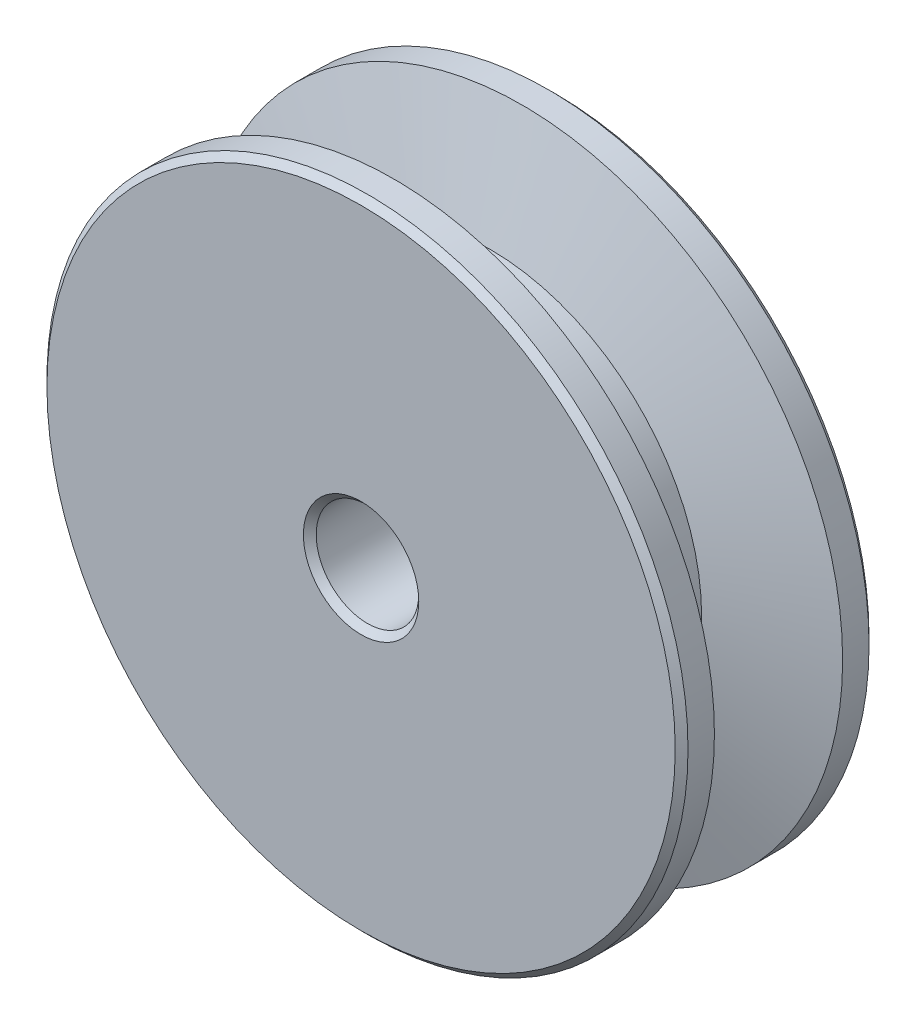
from build123d import *

# Parameters (mm, degrees)
EXTRUDE_1_DEPTH      = 7.56
EXTRUDE_1_DEPTH_BACK = 7.56
SKETCH_1_R           = 25
SKETCH_1_R_2         = 4
SKETCH_4_R           = 2.1
CUT_EXTRUDE_1_DEPTH  = 37.15457924
SKETCH_5_R           = 2.1
CUT_EXTRUDE_2_DEPTH  = 37.154579261
CHAMFER_1_SIZE       = 0.5


with BuildPart() as part:
    # 草图1 → 凸台-拉伸1 (new, two sides: drawn at the far end of the back side and taken through both)
    with BuildSketch(Plane.XY.offset(-EXTRUDE_1_DEPTH_BACK)):
        Circle(SKETCH_1_R)
        Circle(SKETCH_1_R_2, mode=Mode.SUBTRACT)
    extrude(amount=EXTRUDE_1_DEPTH + EXTRUDE_1_DEPTH_BACK)

    # 草图3 → 切除-旋转2 (revolve, cut)
    with BuildSketch(Plane(origin=(0, 0, 0), x_dir=(0, 0, -1), z_dir=(1, 0, 0))):
        Polygon((-5, 25), (5, 25), (2.5, 16.5), (-2.5, 16.5), align=None)
    revolve(axis=Axis((0, 0, 7.56), (0, 0, -1)), mode=Mode.SUBTRACT)

    # 草图4 → 切除-拉伸1 (cut, through all)
    with BuildSketch(Plane(origin=(0, 0, 0), x_dir=(1, 0, 0), z_dir=(0, 1, 0))):
        Circle(SKETCH_4_R)
    extrude(amount=CUT_EXTRUDE_1_DEPTH, mode=Mode.SUBTRACT)

    # 草图5 → 切除-拉伸2 (cut, through all)
    with BuildSketch(Plane(origin=(0, 0, 0), x_dir=(0, 0, -1), z_dir=(1, 0, 0))):
        Circle(SKETCH_5_R)
    extrude(amount=CUT_EXTRUDE_2_DEPTH, mode=Mode.SUBTRACT)

    # 倒角1
    chamfer_1_edges = [part.edges().sort_by_distance(p)[0] for p in [
        (-4, 0, 7.56),
        (-4, 0, -7.56),
        (-25, 0, -7.56),
        (-25, 0, 7.56),
    ]]
    chamfer(chamfer_1_edges, length=CHAMFER_1_SIZE)


solid = part.part
